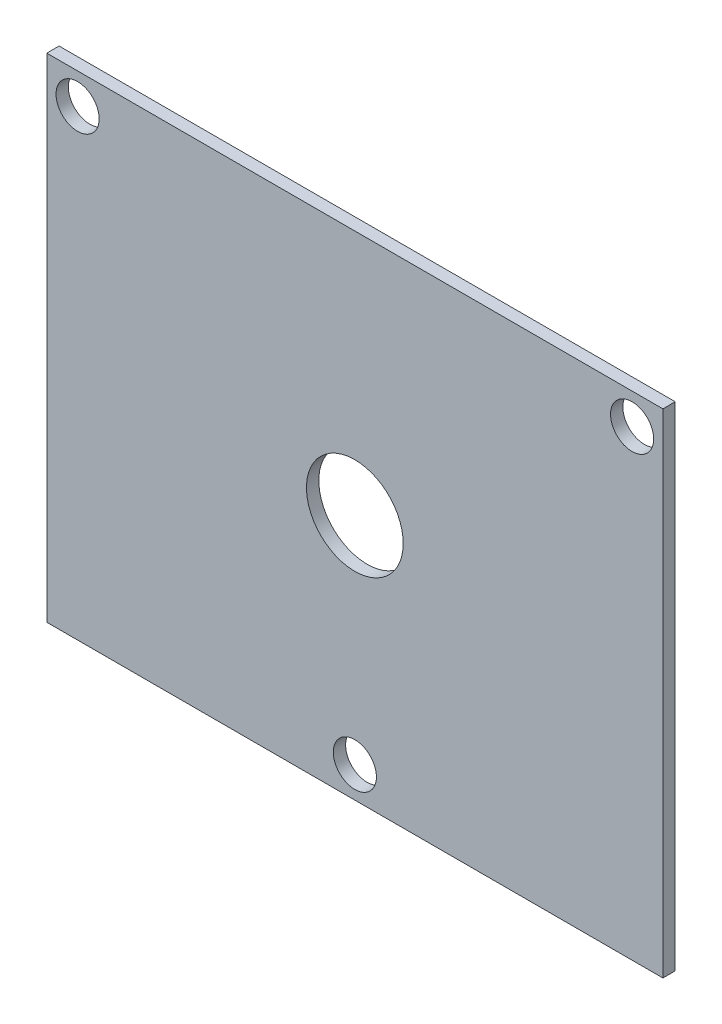
from build123d import *

# Parameters (mm, degrees)
SKETCH2_W           = 254
SKETCH2_H           = 203.2
BOSS_EXTRUDE1_DEPTH = 5.08
SKETCH4_R           = 19.939
CUT_EXTRUDE2_DEPTH  = 326.318376979
SKETCH3_R           = 8.89
CUT_EXTRUDE3_DEPTH  = 326.318376979


with BuildPart() as part:
    # Sketch2 → Boss-Extrude1 (new body)
    with BuildSketch(Plane.XY):
        with Locations((127, 101.6)):
            Rectangle(SKETCH2_W, SKETCH2_H)
    extrude(amount=BOSS_EXTRUDE1_DEPTH)

    # Sketch4 → Cut-Extrude2 (cut, through all)
    with BuildSketch(Plane.XY.offset(5.08)):
        with Locations((127, 101.6)):
            Circle(SKETCH4_R)
    extrude(amount=-CUT_EXTRUDE2_DEPTH, mode=Mode.SUBTRACT)

    # Sketch3 → Cut-Extrude3 (cut, through all)
    with BuildSketch(Plane.XY.offset(5.08)):
        with Locations((12.7, 190.5)):
            Circle(SKETCH3_R)
        with Locations((241.3, 190.5)):
            Circle(SKETCH3_R)
        with Locations((127, 12.7)):
            Circle(SKETCH3_R)
    extrude(amount=-CUT_EXTRUDE3_DEPTH, mode=Mode.SUBTRACT)


solid = part.part
